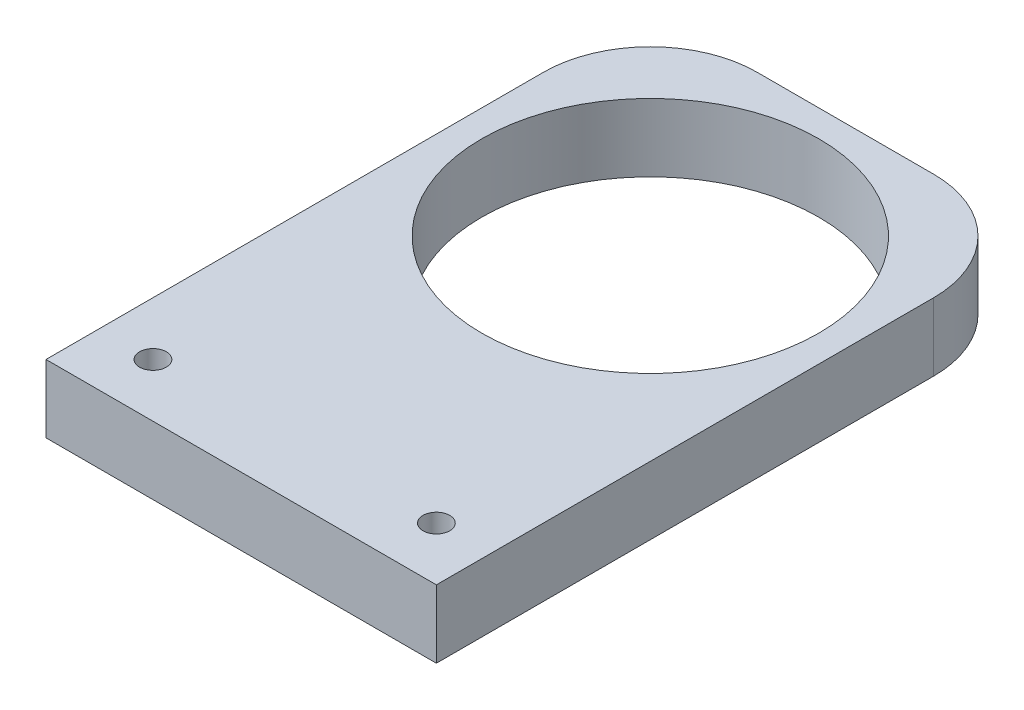
from build123d import *

# Parameters (mm, degrees)
SKETCH2_W              = 73
SKETCH2_H              = 73
SKETCH2_R              = 31.5
BOSS_EXTRUDE2_DEPTH    = 6.35
SKETCH3_W              = 73
SKETCH3_H              = 40
SKETCH3_R              = 2.5
BOTTOM_MOUNT_DEPTH     = 12.7
BOTTOM_MOUNT_FILLETS_R = 20


with BuildPart() as part:
    # Sketch2 → Boss-Extrude2 (new, symmetric)
    with BuildSketch(Plane(origin=(0, 0, 0), x_dir=(1, 0, 0), z_dir=(0, 1, 0))):
        Rectangle(SKETCH2_W, SKETCH2_H)
        with Locations(Location((0, 0, 0), (0, 0, 270))):
            Circle(SKETCH2_R, mode=Mode.SUBTRACT)
    extrude(amount=BOSS_EXTRUDE2_DEPTH, both=True)

    # Sketch3 → Bottom Mount (add, through all)
    with BuildSketch(Plane(origin=(0, 6.35, 0), x_dir=(1, 0, 0), z_dir=(0, 1, 0))):
        with Locations((0, -56.5)):
            Rectangle(SKETCH3_W, SKETCH3_H)
        with Locations(Location((-26.5, -66.5, 0), (0, 0, 270))):
            Circle(SKETCH3_R, mode=Mode.SUBTRACT)
        with Locations(Location((26.5, -66.5, 0), (0, 0, 270))):
            Circle(SKETCH3_R, mode=Mode.SUBTRACT)
    extrude(amount=-BOTTOM_MOUNT_DEPTH)

    # Bottom Mount Fillets
    bottom_mount_fillets_edges = [part.edges().sort_by_distance(p)[0] for p in [
        (-36.5, 0, -36.5),
        (36.5, 0, -36.5),
    ]]
    fillet(bottom_mount_fillets_edges, radius=BOTTOM_MOUNT_FILLETS_R)


solid = part.part
